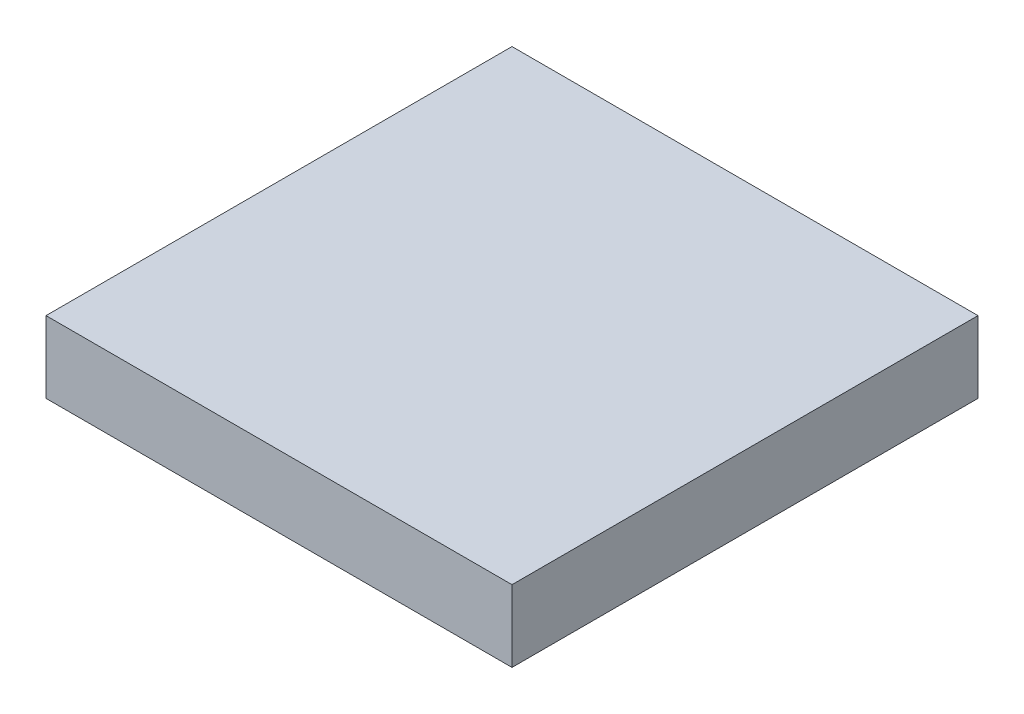
from build123d import *

# Parameters (mm, degrees)
SKETCH1_W           = 16.51
SKETCH1_H           = 16.51
BOSS_EXTRUDE1_DEPTH = 2.54
SKETCH3_W           = 1.016
SKETCH3_H           = 3.302
SKETCH3_W_2         = 3.302
SKETCH3_H_2         = 1.016
BOSS_EXTRUDE2_DEPTH = 2.032


with BuildPart() as part:
    # Sketch1 → Boss-Extrude1 (new body)
    with BuildSketch(Plane(origin=(0, 0, 0), x_dir=(1, 0, 0), z_dir=(0, 1, 0))):
        Rectangle(SKETCH1_W, SKETCH1_H)
    extrude(amount=BOSS_EXTRUDE1_DEPTH)

    # Sketch3 → Boss-Extrude2 (add)
    with BuildSketch(Plane.XZ):
        with Locations((-4.445, -4.064)):
            Rectangle(SKETCH3_W, SKETCH3_H)
        with Locations((4.064, 4.445)):
            Rectangle(SKETCH3_W_2, SKETCH3_H_2)
    extrude(amount=BOSS_EXTRUDE2_DEPTH)


solid = part.part
